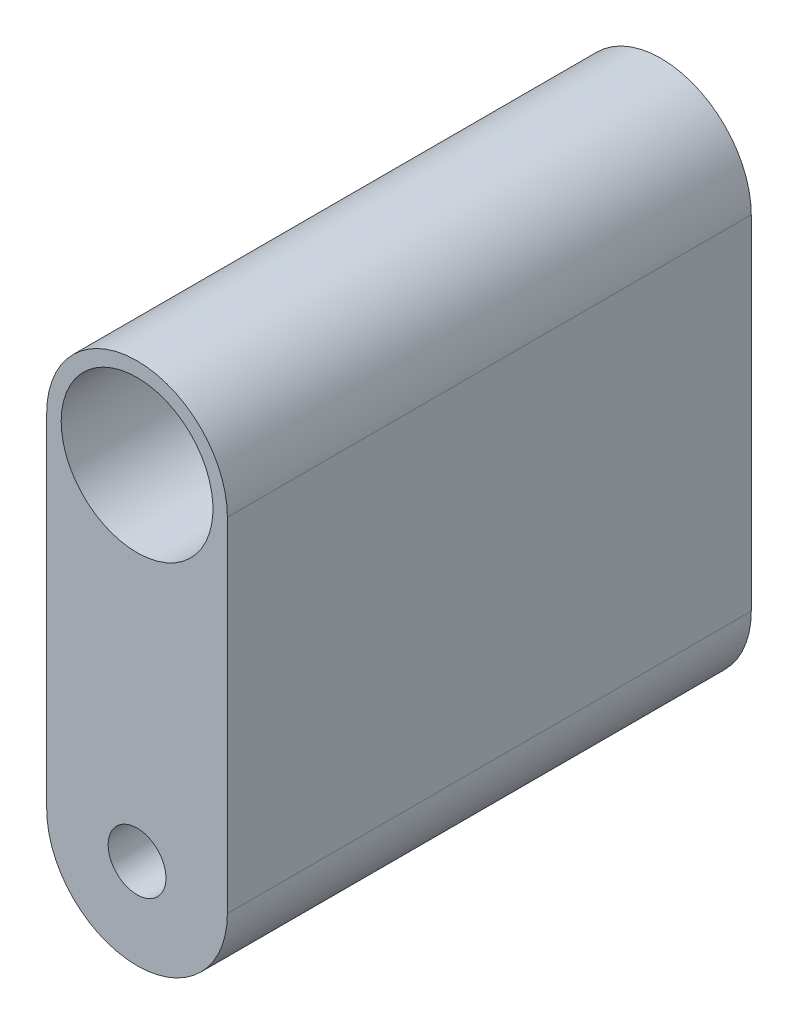
from build123d import *

# Parameters (mm, degrees)
SKETCH3_R           = 1.6
SKETCH3_R_2         = 4.2
BOSS_EXTRUDE1_DEPTH = 29


with BuildPart() as part:
    # Sketch3 → Boss-Extrude1 (new body)
    with BuildSketch(Plane(origin=(0, 0, 0), x_dir=(0, 1, 0), z_dir=(0, 0, 1))):
        with BuildLine():
            Line((0, 5), (19, 5))
            ThreePointArc((19, 5), (24, 0), (19, -5))
            Line((19, -5), (0, -5))
            ThreePointArc((0, -5), (-5, 0), (0, 5))
        make_face()
        with Locations(Location((0, 0, 0), (0, 0, 90))):
            Circle(SKETCH3_R, mode=Mode.SUBTRACT)
        with Locations(Location((19, 0, 0), (0, 0, 90))):
            Circle(SKETCH3_R_2, mode=Mode.SUBTRACT)
    extrude(amount=BOSS_EXTRUDE1_DEPTH)


solid = part.part
